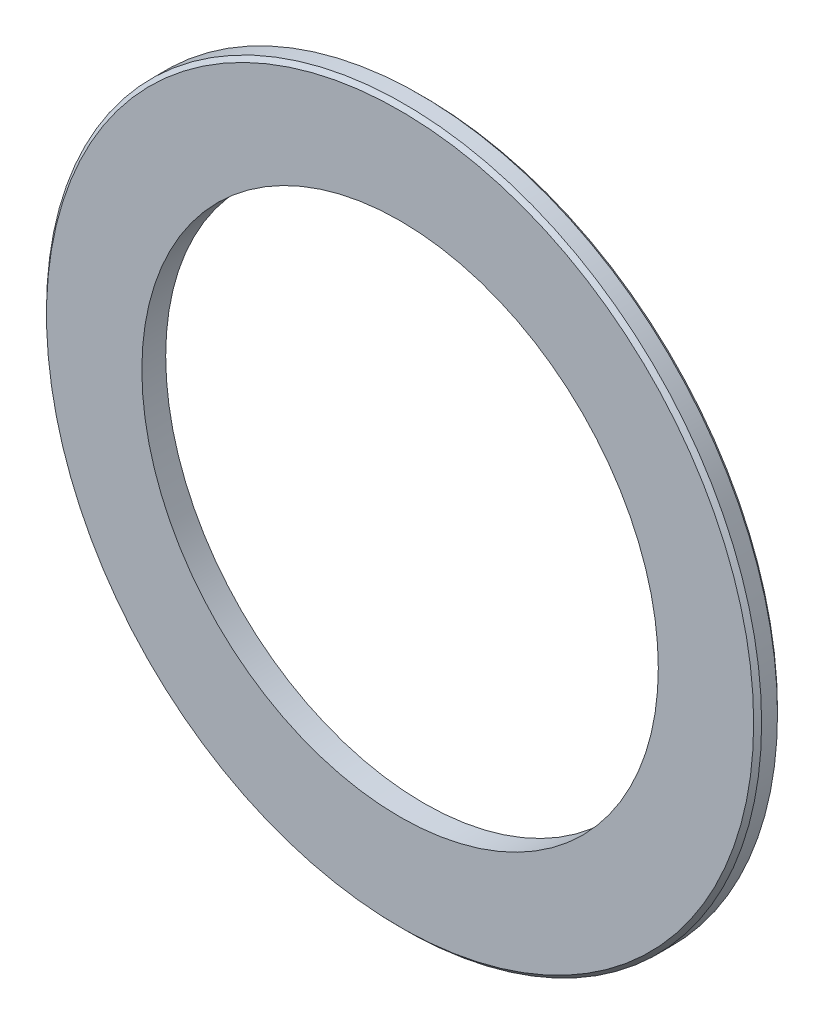
from build123d import *

# Parameters (mm, degrees)
SKETCH_1_R      = 45
SKETCH_1_R_2    = 32.5
EXTRUDE_1_DEPTH = 3
CHAMFER_1_SIZE  = 0.5


with BuildPart() as part:
    # Эскиз1 → Бобышка-Вытянуть1 (new body)
    with BuildSketch(Plane.XY):
        Circle(SKETCH_1_R)
        Circle(SKETCH_1_R_2, mode=Mode.SUBTRACT)
    extrude(amount=EXTRUDE_1_DEPTH)

    # Фаска1
    chamfer_1_edges = [part.edges().sort_by_distance(p)[0] for p in [
        (-45, 0, 0),
        (-45, 0, 3),
    ]]
    chamfer(chamfer_1_edges, length=CHAMFER_1_SIZE)


solid = part.part
